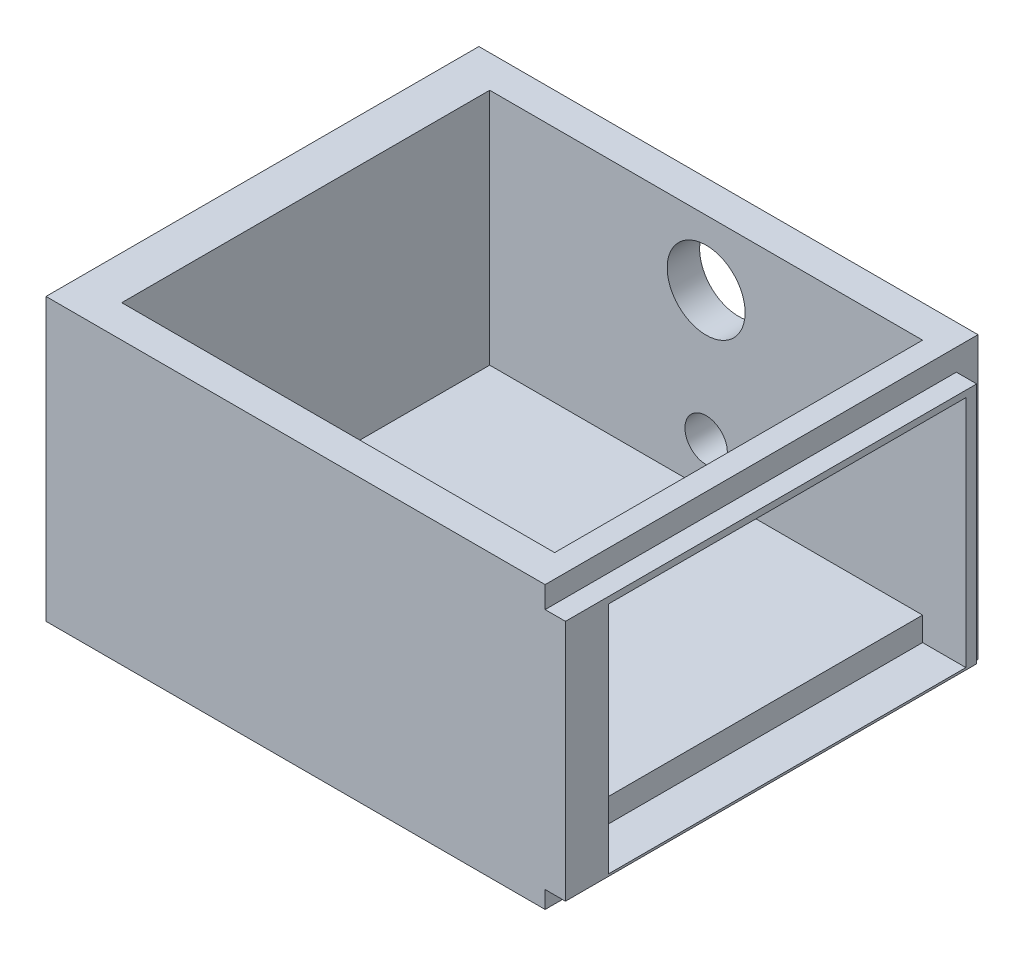
from build123d import *

# Parameters (mm, degrees)
SKETCH2_W           = 120
SKETCH2_H           = 100
BOSS_EXTRUDE2_DEPTH = 65
SKETCH3_W           = 100
SKETCH3_H           = 85
CUT_EXTRUDE1_DEPTH  = 55
SKETCH6_R           = 9
SKETCH6_R_2         = 4.9
CUT_EXTRUDE3_DEPTH  = 30
SKETCH8_W           = 4.7
SKETCH8_H           = 4
SKETCH8_H_2         = 5
CUT_EXTRUDE6_DEPTH  = 95
SKETCH9_W           = 5
SKETCH9_H           = 65
CUT_EXTRUDE7_DEPTH  = 4.7
SKETCH10_W          = 82.5
SKETCH10_H          = 54
CUT_EXTRUDE9_DEPTH  = 10


with BuildPart() as part:
    # Sketch2 → Boss-Extrude2 (new body)
    with BuildSketch(Plane(origin=(0, 0, 0), x_dir=(1, 0, 0), z_dir=(0, 1, 0))):
        Rectangle(SKETCH2_W, SKETCH2_H)
    extrude(amount=BOSS_EXTRUDE2_DEPTH)

    # Sketch3 → Cut-Extrude1 (cut)
    with BuildSketch(Plane(origin=(0, 65, 0), x_dir=(1, 0, 0), z_dir=(0, 1, 0))):
        Rectangle(SKETCH3_W, SKETCH3_H)
    extrude(amount=-CUT_EXTRUDE1_DEPTH, mode=Mode.SUBTRACT)

    # Sketch6 → Cut-Extrude3 (cut)
    with BuildSketch(Plane.XY.offset(-42.5)):
        with Locations((0, 50)):
            Circle(SKETCH6_R)
        with Locations((0, 20)):
            Circle(SKETCH6_R_2)
    extrude(amount=-CUT_EXTRUDE3_DEPTH, mode=Mode.SUBTRACT)

    # Sketch8 → Cut-Extrude6 (cut)
    with BuildSketch(Plane.XY.offset(50)):
        with Locations((57.65, 2)):
            Rectangle(SKETCH8_W, SKETCH8_H)
        with Locations((57.65, 62.5)):
            Rectangle(SKETCH8_W, SKETCH8_H_2)
    extrude(amount=-CUT_EXTRUDE6_DEPTH, mode=Mode.SUBTRACT)

    # Sketch9 → Cut-Extrude7 (cut)
    with BuildSketch(Plane(origin=(60, 0, 0), x_dir=(0, 0, -1), z_dir=(1, 0, 0))):
        with Locations((47.5, 32.5)):
            Rectangle(SKETCH9_W, SKETCH9_H)
    extrude(amount=-CUT_EXTRUDE7_DEPTH, mode=Mode.SUBTRACT)

    # Sketch10 → Cut-Extrude9 (cut)
    with BuildSketch(Plane(origin=(60, 0, 0), x_dir=(0, 0, -1), z_dir=(1, 0, 0))):
        with Locations((1.25, 31.5)):
            Rectangle(SKETCH10_W, SKETCH10_H)
    extrude(amount=-CUT_EXTRUDE9_DEPTH, mode=Mode.SUBTRACT)


solid = part.part
